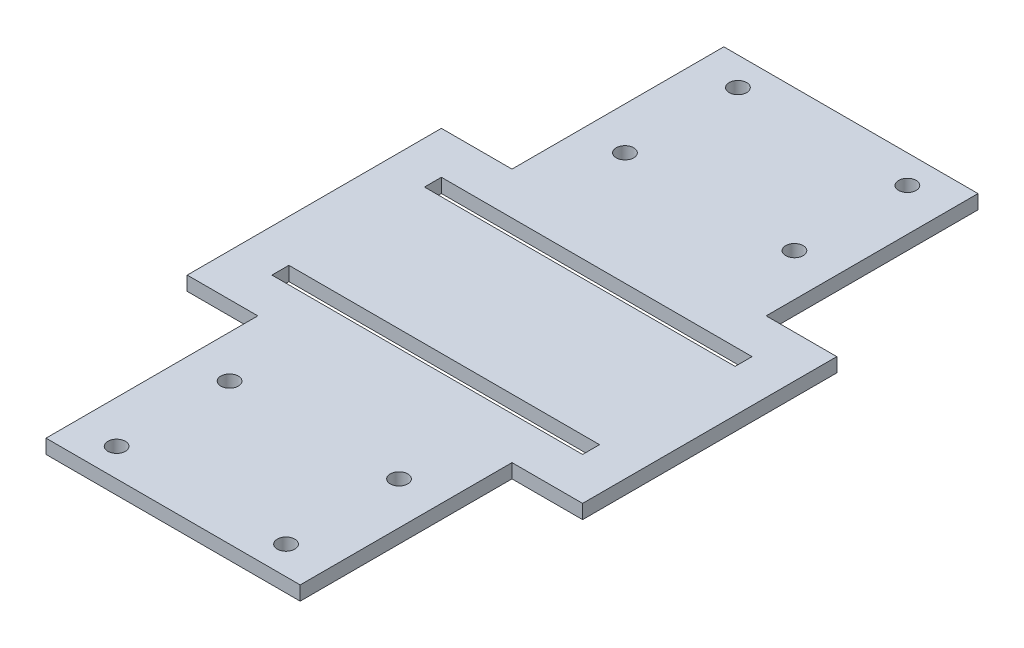
from build123d import *

# Parameters (mm, degrees)
EXTRUDE_1_DEPTH      = 5
SKETCH_3_W           = 30
SKETCH_3_H           = 90
CUT_EXTRUDE_2_DEPTH  = 5
SKETCH_5_W           = 30
SKETCH_5_H           = 90
CUT_EXTRUDE_3_DEPTH  = 5
SKETCH_7_W           = 90
SKETCH_7_H           = 20
EXTRUDE_2_DEPTH      = 5
SKETCH_9_W           = 90
SKETCH_9_H           = 20
EXTRUDE_3_DEPTH      = 5
SKETCH_10_R          = 3.1
CUT_EXTRUDE_4_DEPTH  = 5
SKETCH_11_R          = 3.1
CUT_EXTRUDE_5_DEPTH  = 5
SKETCH_12_R          = 3.1
CUT_EXTRUDE_7_DEPTH  = 5
SKETCH_13_R          = 3.1
CUT_EXTRUDE_8_DEPTH  = 5
SKETCH_14_W          = 100
SKETCH_14_H          = 6
CUT_EXTRUDE_9_DEPTH  = 5
SKETCH_15_W          = 100
SKETCH_15_H          = 6
CUT_EXTRUDE_10_DEPTH = 5
SKETCH_16_W          = 5
SKETCH_16_H          = 6
CUT_EXTRUDE_11_DEPTH = 5
SKETCH_17_W          = 5
SKETCH_17_H          = 6
CUT_EXTRUDE_12_DEPTH = 5
SKETCH_18_W          = 5
SKETCH_18_H          = 6
CUT_EXTRUDE_13_DEPTH = 5
SKETCH_19_W          = 5
SKETCH_19_H          = 6
CUT_EXTRUDE_14_DEPTH = 5


with BuildPart() as part:
    # 草图1 → 凸台-拉伸1 (new body)
    with BuildSketch(Plane(origin=(0, 0, 0), x_dir=(1, 0, 0), z_dir=(0, 1, 0))):
        Polygon((45, 45), (100, 45), (100, -45), (45, -45), (45, -100), (-45, -100), (-45, -45), (-100, -45), (-100, 45), (-45, 45), (-45, 100), (45, 100), align=None)
    extrude(amount=EXTRUDE_1_DEPTH)

    # 草图3 → 切除-拉伸2 (cut)
    with BuildSketch(Plane(origin=(0, 5, 0), x_dir=(1, 0, 0), z_dir=(0, 1, 0))):
        with Locations((-85, 0)):
            Rectangle(SKETCH_3_W, SKETCH_3_H)
    extrude(amount=-CUT_EXTRUDE_2_DEPTH, mode=Mode.SUBTRACT)

    # 草图5 → 切除-拉伸3 (cut)
    with BuildSketch(Plane(origin=(0, 5, 0), x_dir=(1, 0, 0), z_dir=(0, 1, 0))):
        with Locations((85, 0)):
            Rectangle(SKETCH_5_W, SKETCH_5_H)
    extrude(amount=-CUT_EXTRUDE_3_DEPTH, mode=Mode.SUBTRACT)

    # 草图7 → 凸台-拉伸2 (add)
    with BuildSketch(Plane(origin=(0, 5, 0), x_dir=(1, 0, 0), z_dir=(0, 1, 0))):
        with Locations((0, 110)):
            Rectangle(SKETCH_7_W, SKETCH_7_H)
    extrude(amount=-EXTRUDE_2_DEPTH)

    # 草图9 → 凸台-拉伸3 (add)
    with BuildSketch(Plane(origin=(0, 5, 0), x_dir=(1, 0, 0), z_dir=(0, 1, 0))):
        with Locations((0, -110)):
            Rectangle(SKETCH_9_W, SKETCH_9_H)
    extrude(amount=-EXTRUDE_3_DEPTH)

    # 草图10 → 切除-拉伸4 (cut)
    with BuildSketch(Plane(origin=(0, 5, 0), x_dir=(1, 0, 0), z_dir=(0, 1, 0))):
        with Locations(Location((-30, 110, 0), (0, 0, 270))):
            Circle(SKETCH_10_R)
        with Locations(Location((-30, 70, 0), (0, 0, 270))):
            Circle(SKETCH_10_R)
    extrude(amount=-CUT_EXTRUDE_4_DEPTH, mode=Mode.SUBTRACT)

    # 草图11 → 切除-拉伸5 (cut)
    with BuildSketch(Plane(origin=(0, 5, 0), x_dir=(1, 0, 0), z_dir=(0, 1, 0))):
        with Locations(Location((30, 110, 0), (0, 0, 270))):
            Circle(SKETCH_11_R)
        with Locations(Location((30, 70, 0), (0, 0, 270))):
            Circle(SKETCH_11_R)
    extrude(amount=-CUT_EXTRUDE_5_DEPTH, mode=Mode.SUBTRACT)

    # 草图12 → 切除-拉伸7 (cut)
    with BuildSketch(Plane(origin=(0, 5, 0), x_dir=(1, 0, 0), z_dir=(0, 1, 0))):
        with Locations(Location((-30, -110, 0), (0, 0, 270))):
            Circle(SKETCH_12_R)
        with Locations(Location((-30, -70, 0), (0, 0, 270))):
            Circle(SKETCH_12_R)
    extrude(amount=-CUT_EXTRUDE_7_DEPTH, mode=Mode.SUBTRACT)

    # 草图13 → 切除-拉伸8 (cut)
    with BuildSketch(Plane(origin=(0, 5, 0), x_dir=(1, 0, 0), z_dir=(0, 1, 0))):
        with Locations(Location((30, -110, 0), (0, 0, 270))):
            Circle(SKETCH_13_R)
        with Locations(Location((30, -70, 0), (0, 0, 270))):
            Circle(SKETCH_13_R)
    extrude(amount=-CUT_EXTRUDE_8_DEPTH, mode=Mode.SUBTRACT)

    # 草图14 → 切除-拉伸9 (cut)
    with BuildSketch(Plane(origin=(0, 5, 0), x_dir=(1, 0, 0), z_dir=(0, 1, 0))):
        with Locations((0, 27)):
            Rectangle(SKETCH_14_W, SKETCH_14_H)
    extrude(amount=-CUT_EXTRUDE_9_DEPTH, mode=Mode.SUBTRACT)

    # 草图15 → 切除-拉伸10 (cut)
    with BuildSketch(Plane(origin=(0, 5, 0), x_dir=(1, 0, 0), z_dir=(0, 1, 0))):
        with Locations((0, -27)):
            Rectangle(SKETCH_15_W, SKETCH_15_H)
    extrude(amount=-CUT_EXTRUDE_10_DEPTH, mode=Mode.SUBTRACT)

    # 草图16 → 切除-拉伸11 (cut)
    with BuildSketch(Plane(origin=(0, 5, 0), x_dir=(1, 0, 0), z_dir=(0, 1, 0))):
        with Locations((52.5, 27)):
            Rectangle(SKETCH_16_W, SKETCH_16_H)
    extrude(amount=-CUT_EXTRUDE_11_DEPTH, mode=Mode.SUBTRACT)

    # 草图17 → 切除-拉伸12 (cut)
    with BuildSketch(Plane(origin=(0, 5, 0), x_dir=(1, 0, 0), z_dir=(0, 1, 0))):
        with Locations((52.5, -27)):
            Rectangle(SKETCH_17_W, SKETCH_17_H)
    extrude(amount=-CUT_EXTRUDE_12_DEPTH, mode=Mode.SUBTRACT)

    # 草图18 → 切除-拉伸13 (cut)
    with BuildSketch(Plane(origin=(0, 5, 0), x_dir=(1, 0, 0), z_dir=(0, 1, 0))):
        with Locations((-52.5, 27)):
            Rectangle(SKETCH_18_W, SKETCH_18_H)
    extrude(amount=-CUT_EXTRUDE_13_DEPTH, mode=Mode.SUBTRACT)

    # 草图19 → 切除-拉伸14 (cut)
    with BuildSketch(Plane(origin=(0, 5, 0), x_dir=(1, 0, 0), z_dir=(0, 1, 0))):
        with Locations((-52.5, -27)):
            Rectangle(SKETCH_19_W, SKETCH_19_H)
    extrude(amount=-CUT_EXTRUDE_14_DEPTH, mode=Mode.SUBTRACT)


solid = part.part
